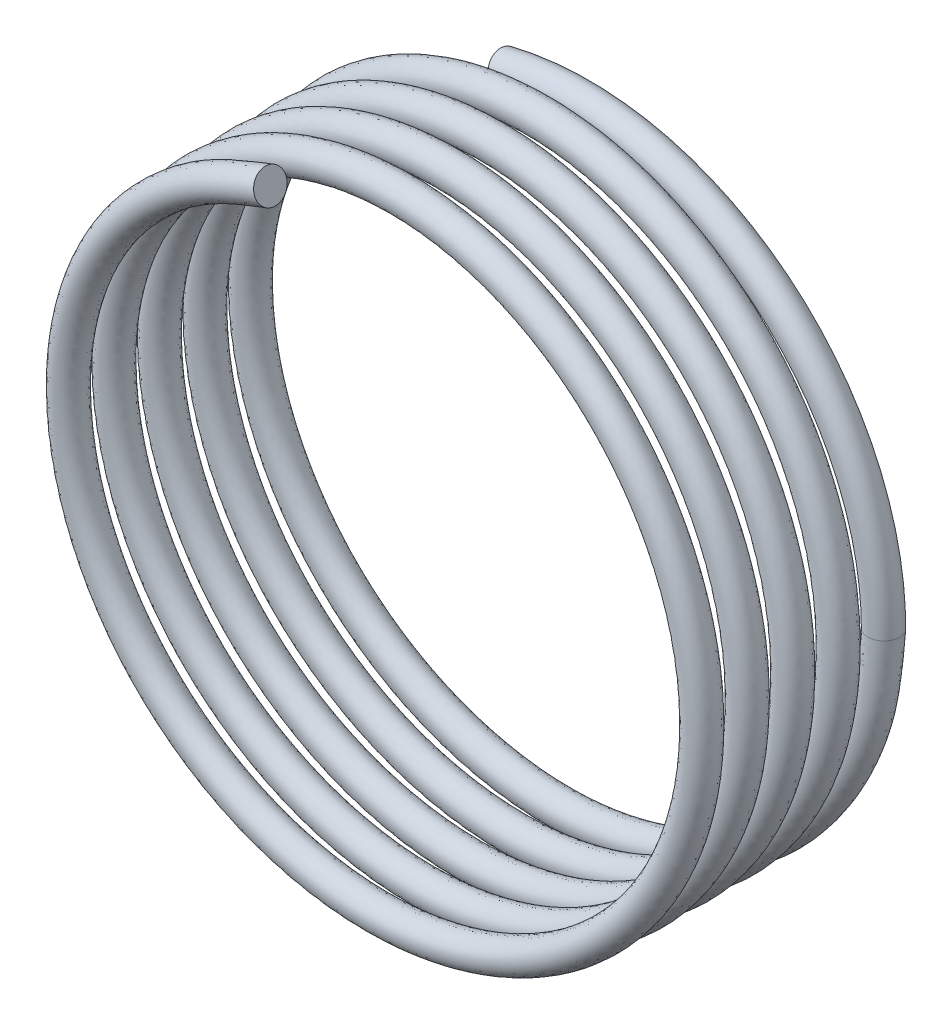
from build123d import *

# Parameters (mm, degrees)
BASE_SWEEP_PITCH  = 1.729361702
BASE_SWEEP_HEIGHT = 8.128
BASE_SWEEP_RADIUS = 11.6078
SKETCH2_R         = 0.5969
SKETCH4_R         = 0.5969


with BuildPart() as part:
    # Base-Sweep: sweep along a helix
    with BuildLine() as base_sweep_path:
        Helix(BASE_SWEEP_PITCH, BASE_SWEEP_HEIGHT, BASE_SWEEP_RADIUS, center=(0, 0, 0), direction=(0, 0, 1), lefthand=True)
    # Sketch2 → Base-Sweep (sweep)
    with BuildSketch(Plane(origin=(-3.587007467, 11.03967383, 8.128), x_dir=(-0.30983827496343924, 0.9480025813598894, 0.07274166002138369), z_dir=(0.9507892739023093, 0.30893016205777607, 0.02370467471356661))):
        Circle(SKETCH2_R)
    sweep(path=base_sweep_path.line, is_frenet=True)

    # Boss-Sweep1: sweep along a path in Sketch3
    with BuildLine(Plane.XY) as boss_sweep1_path:
        ThreePointArc((11.6078, 0), (7.146475273, 9.147071226), (-2.80818098, 11.262998731))
    # Sketch4 → Boss-Sweep1 (sweep)
    with BuildSketch(Plane(origin=(0, 0, 0), x_dir=(-1, 0, 0), z_dir=(0, 0.9997190047191882, -0.023704674713565944))):
        with Locations((-11.6078, 0)):
            Circle(SKETCH4_R)
    sweep(path=boss_sweep1_path.line)


solid = part.part
